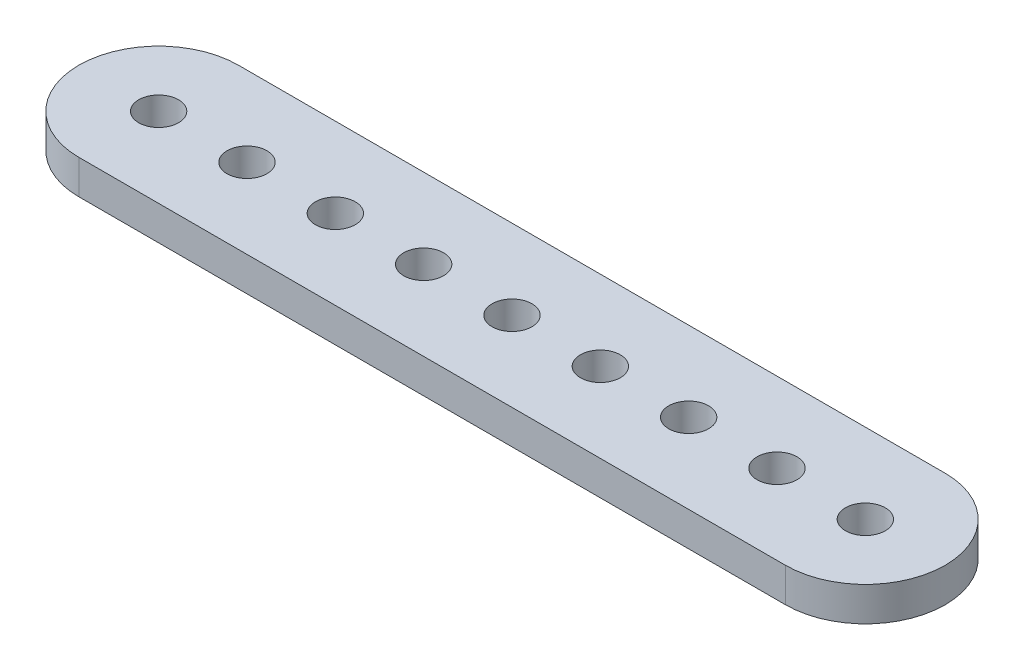
from build123d import *

# Parameters (mm, degrees)
SKETCH1_R           = 3.5
BOSS_EXTRUDE1_DEPTH = 6


with BuildPart() as part:
    # Sketch1 → Boss-Extrude1 (new body)
    with BuildSketch(Plane(origin=(0, 0, 0), x_dir=(1, 0, 0), z_dir=(0, 1, 0))):
        with BuildLine():
            Line((-104.874279125, 23.455877626), (19.125720875, 23.455877626))
            ThreePointArc((19.125720875, 23.455877626), (33.125720875, 9.455877626), (19.125720875, -4.544122374))
            Line((19.125720875, -4.544122374), (-104.874279125, -4.544122374))
            ThreePointArc((-104.874279125, -4.544122374), (-118.874279125, 9.455877626), (-104.874279125, 23.455877626))
        make_face()
        with Locations(Location((-104.874279125, 9.455877626, 0), (0, 0, 270))):
            Circle(SKETCH1_R, mode=Mode.SUBTRACT)
        with Locations(Location((-89.374279125, 9.455877626, 0), (0, 0, 270))):
            Circle(SKETCH1_R, mode=Mode.SUBTRACT)
        with Locations(Location((-73.874279125, 9.455877626, 0), (0, 0, 270))):
            Circle(SKETCH1_R, mode=Mode.SUBTRACT)
        with Locations(Location((-58.374279125, 9.455877626, 0), (0, 0, 270))):
            Circle(SKETCH1_R, mode=Mode.SUBTRACT)
        with Locations(Location((-42.874279125, 9.455877626, 0), (0, 0, 270))):
            Circle(SKETCH1_R, mode=Mode.SUBTRACT)
        with Locations(Location((-27.374279125, 9.455877626, 0), (0, 0, 270))):
            Circle(SKETCH1_R, mode=Mode.SUBTRACT)
        with Locations(Location((-11.874279125, 9.455877626, 0), (0, 0, 270))):
            Circle(SKETCH1_R, mode=Mode.SUBTRACT)
        with Locations(Location((3.625720875, 9.455877626, 0), (0, 0, 270))):
            Circle(SKETCH1_R, mode=Mode.SUBTRACT)
        with Locations(Location((19.125720875, 9.455877626, 0), (0, 0, 270))):
            Circle(SKETCH1_R, mode=Mode.SUBTRACT)
    extrude(amount=BOSS_EXTRUDE1_DEPTH)


solid = part.part
